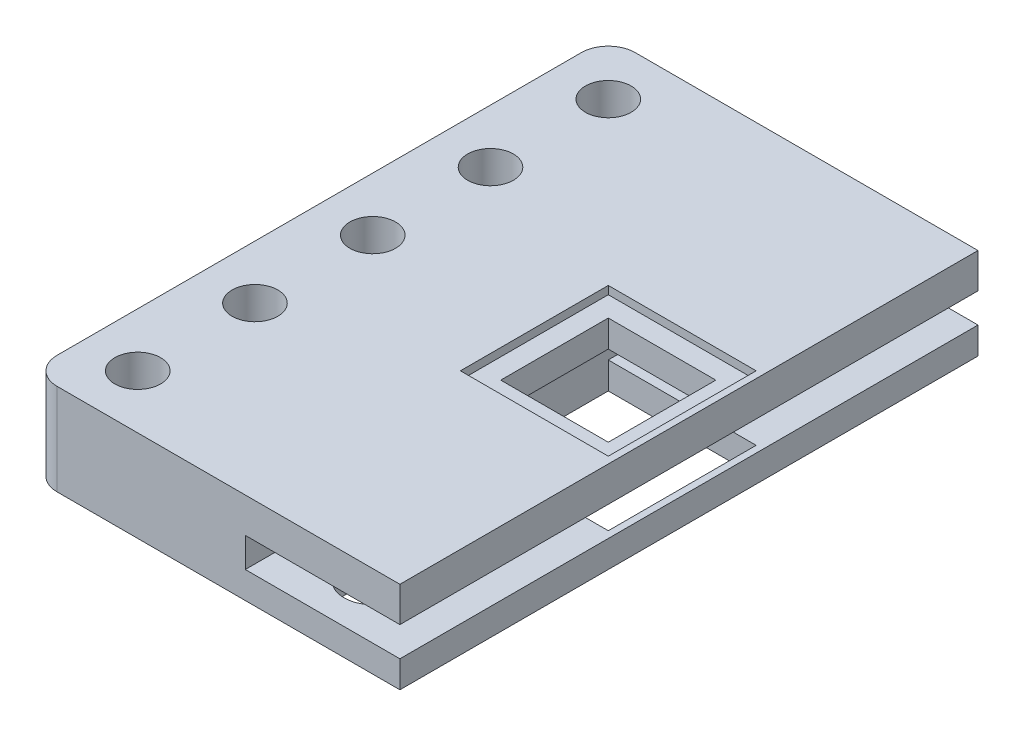
from build123d import *

# Parameters (mm, degrees)
SKETCH1_W                          = 21.5
SKETCH1_H                          = 21.5
BOSS_EXTRUDE1_DEPTH                = 3.1
SKETCH2_W                          = 5.5
SKETCH2_H                          = 1.1
CUT_EXTRUDE1_DEPTH                 = 27.219811656
SKETCH3_W                          = 21.5
SKETCH3_H                          = 21.5
SKETCH3_W_2                        = 5.5
SKETCH3_H_2                        = 5.5
BOSS_EXTRUDE2_DEPTH                = 0.3
SKETCH11_W                         = 4
SKETCH11_H                         = 4
CUT_EXTRUDE2_DEPTH                 = 19.85301637
TAP_DRILL_FOR_M2X0_4_TAP3_D        = 1.7
TAP_DRILL_FOR_M2_5X0_45_TAP1_D     = 2.15
TAP_DRILL_FOR_M2_5X0_45_TAP1_DEPTH = 1
CUT_EXTRUDE3_REACH                 = 20.905
SKETCH18_W                         = 5.5
SKETCH18_H                         = 5.5
FILLET3_R                          = 1
SKETCH21_W                         = 13.124555245
SKETCH21_H                         = 35.298127434
CUT_EXTRUDE8_DEPTH                 = 19.904661496
SKETCH22_W                         = 0.25
SKETCH22_H                         = 1.1
CUT_EXTRUDE9_DEPTH                 = 27.256970946


with BuildPart() as part:
    # Sketch1 → Boss-Extrude1 (new body)
    with BuildSketch(Plane(origin=(0, 0, 0), x_dir=(1, 0, 0), z_dir=(0, 1, 0))):
        with Locations((-3.933954619, -0.660858995)):
            Rectangle(SKETCH1_W, SKETCH1_H)
    extrude(amount=BOSS_EXTRUDE1_DEPTH)

    # Sketch2 → Cut-Extrude1 (cut, through all)
    with BuildSketch(Plane.XY.offset(11.410858995)):
        with Locations((-3.933954619, 1.55)):
            Rectangle(SKETCH2_W, SKETCH2_H)
    extrude(amount=-CUT_EXTRUDE1_DEPTH, mode=Mode.SUBTRACT)

    # Sketch3 → Boss-Extrude2 (add)
    with BuildSketch(Plane(origin=(0, 3.1, 0), x_dir=(1, 0, 0), z_dir=(0, 1, 0))):
        with Locations((-3.933954619, -0.660858995)):
            Rectangle(SKETCH3_W, SKETCH3_H)
        with Locations((-3.933954619, -0.660858995)):
            Rectangle(SKETCH3_W_2, SKETCH3_H_2, mode=Mode.SUBTRACT)
    extrude(amount=BOSS_EXTRUDE2_DEPTH)

    # Sketch11 → Cut-Extrude2 (cut, through all)
    with BuildSketch(Plane(origin=(0, 3.1, 0), x_dir=(1, 0, 0), z_dir=(0, 1, 0))):
        with Locations((-3.933954619, -0.660858995)):
            Rectangle(SKETCH11_W, SKETCH11_H)
    extrude(amount=-CUT_EXTRUDE2_DEPTH, mode=Mode.SUBTRACT)

    # Tap Drill for M2x0.4 Tap3 (through all)
    with Locations(Plane(origin=(0, 3.4, 0), x_dir=(1, 0, 0), z_dir=(0, 1, 0))):
        with Locations((-12.683954619, 8.089141005), (4.816045381, 8.089141005), (4.816045381, -9.410858995), (-12.683954619, -9.410858995), (-12.683954619, 3.709141005), (-12.683954619, -0.670858995), (-12.683954619, -5.050858995)):
            Hole(TAP_DRILL_FOR_M2X0_4_TAP3_D / 2)

    # Tap Drill for M2.5x0.45 Tap1
    with Locations(Plane(origin=(0, 0, 0), x_dir=(-1, 0, 0), z_dir=(0, -1, 0))):
        with Locations((3.933954619, 8.089141005), (3.933954619, -9.410858995), (3.933954619, 4.539141005), (3.933954619, -5.860858995)):
            Hole(TAP_DRILL_FOR_M2_5X0_45_TAP1_D / 2, depth=TAP_DRILL_FOR_M2_5X0_45_TAP1_DEPTH)

    # Sketch18 → Cut-Extrude3 (cut, up to next)
    with BuildSketch(Plane.XZ, mode=Mode.PRIVATE) as cut_extrude3_sk1:
        with Locations((-3.933954619, 0.660858995)):
            Rectangle(SKETCH18_W, SKETCH18_H)
    cut_extrude3_tool1 = extrude(cut_extrude3_sk1.sketch, amount=-CUT_EXTRUDE3_REACH, mode=Mode.PRIVATE) & part.part
    add(cut_extrude3_tool1.solids().sort_by_distance((-3.933955, 0, 0.660859))[0], mode=Mode.SUBTRACT)

    # Fillet3
    fillet3_edges = [part.edges().sort_by_distance(p)[0] for p in [
        (-14.683954619, 1.7, -10.089141005),
        (6.816045381, 1.7, -10.089141005),
        (6.816045381, 1.7, 11.410858995),
        (-14.683954619, 1.7, 11.410858995),
    ]]
    fillet(fillet3_edges, radius=FILLET3_R)

    # Sketch21 → Cut-Extrude8 (cut, through all)
    with BuildSketch(Plane(origin=(0, 3.4, 0), x_dir=(1, 0, 0), z_dir=(0, 1, 0))):
        with Locations((5.628323004, -1.911462044)):
            Rectangle(SKETCH21_W, SKETCH21_H)
    extrude(amount=-CUT_EXTRUDE8_DEPTH, mode=Mode.SUBTRACT)

    # Sketch22 → Cut-Extrude9 (cut, through all)
    with BuildSketch(Plane(origin=(0, 0, -10.089141005), x_dir=(-1, 0, 0), z_dir=(0, 0, -1))):
        with Locations((1.058954619, 1.55)):
            Rectangle(SKETCH22_W, SKETCH22_H)
    extrude(amount=-CUT_EXTRUDE9_DEPTH, mode=Mode.SUBTRACT)


solid = part.part
